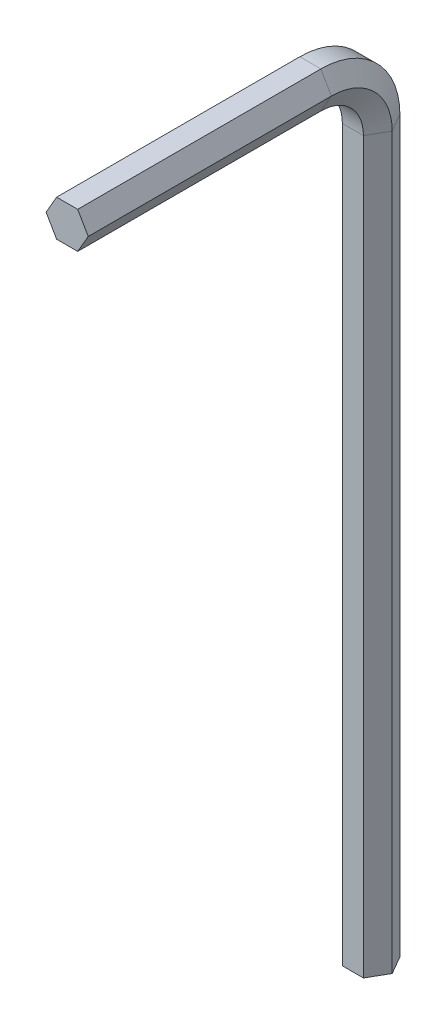
from build123d import *


with BuildPart() as part:
    # Süpür1: sweep along a path in Çizim2
    with BuildLine(Plane(origin=(0, 0, 0), x_dir=(0, 0, -1), z_dir=(1, 0, 0))) as s_p_r1_path:
        Line((0, 0), (20, 0))
        ThreePointArc((20, 0), (23.535533906, -1.464466094), (25, -5))
        Line((25, -5), (25, -65))
    # Çizim1 → Süpür1 (sweep)
    with BuildSketch(Plane.XY):
        Polygon((1.732050808, 0), (0.866025404, 1.5), (-0.866025404, 1.5), (-1.732050808, 0), (-0.866025404, -1.5), (0.866025404, -1.5), align=None)
    sweep(path=s_p_r1_path.line)


solid = part.part
